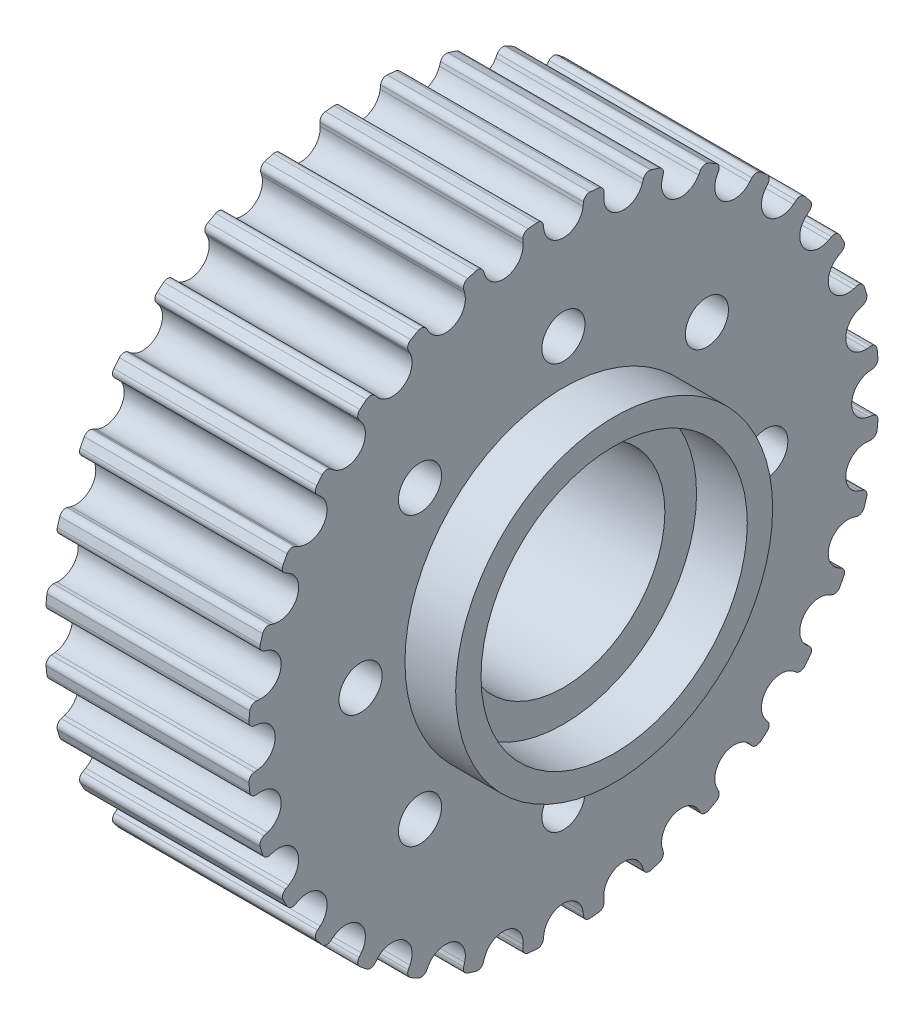
from build123d import *

# Parameters (mm, degrees)
CUT_EXTRUDE_2_REACH      = 42.489
PATTERN_CIRCULAR_3_COUNT = 32
SKETCH_8_R               = 12.5
EXTRUDE_1_DEPTH          = 4
SKETCH_9_R               = 10.5
CUT_EXTRUDE_3_DEPTH      = 4
SKETCH_10_R              = 8
CUT_EXTRUDE_4_DEPTH      = 58.1
SKETCH_11_R              = 1.7
CUT_EXTRUDE_5_DEPTH      = 69


with BuildPart() as part:
    # 草图1 → 旋转1 (revolve)
    with BuildSketch(Plane.XY):
        Polygon((0, 2.7506), (0, 24.893), (16, 24.893), (16, 5.5012), (20, 5.5012), (20, 2.7506), align=None)
    revolve(axis=Axis((0, 0, 0), (1, 0, 0)))

    # 草图6 → 切除-拉伸2 (cut, up to next)
    with BuildSketch(Plane(origin=(0, 0, 0), x_dir=(0, 0, -1), z_dir=(1, 0, 0)), mode=Mode.PRIVATE) as cut_extrude_2_sk1:
        with BuildLine():
            Line((1.582947984, 24.384482643), (1.548371997, 24.102883824))
            ThreePointArc((1.548371997, 24.102883824), (0, 22.733), (-1.548371997, 24.102883824))
            Line((-1.548371997, 24.102883824), (-1.582947984, 24.384482643))
            ThreePointArc((-1.582947984, 24.384482643), (-1.756772423, 24.698590543), (-2.099860763, 24.804274506))
            ThreePointArc((-2.099860763, 24.804274506), (-2.33890774, 24.782876338), (-2.5777373, 24.759174449))
            Line((-2.5777373, 24.759174449), (-2.774385289, 26.360743791))
            ThreePointArc((-2.774385289, 26.360743791), (0, 26.506339373), (2.774385289, 26.360743791))
            Line((2.774385289, 26.360743791), (2.5777373, 24.759174449))
            ThreePointArc((2.5777373, 24.759174449), (2.33890774, 24.782876338), (2.099860763, 24.804274506))
            ThreePointArc((2.099860763, 24.804274506), (1.756772423, 24.698590543), (1.582947984, 24.384482643))
        make_face()
    cut_extrude_2_tool1 = extrude(cut_extrude_2_sk1.sketch, amount=CUT_EXTRUDE_2_REACH, mode=Mode.PRIVATE) & part.part
    cut_extrude_2 = cut_extrude_2_tool1.solids().sort_by_distance((0, 24.97937, 0))[0]
    add(cut_extrude_2, mode=Mode.SUBTRACT)

    # 阵列(圆周)3: 切除-拉伸2 ×32 about axis
    pattern_circular_3_axis = Axis((-1, 0, 0), (1, 0, 0))
    for i in range(1, PATTERN_CIRCULAR_3_COUNT):
        add(cut_extrude_2.rotate(pattern_circular_3_axis, i * 360 / PATTERN_CIRCULAR_3_COUNT), mode=Mode.SUBTRACT)

    # 草图8 → 凸台-拉伸1 (add)
    with BuildSketch(Plane(origin=(16, 0, 0), x_dir=(0, 0, -1), z_dir=(1, 0, 0))):
        Circle(SKETCH_8_R)
    extrude_1 = extrude(amount=EXTRUDE_1_DEPTH)

    # 草图9 → 切除-拉伸3 (cut)
    with BuildSketch(Plane(origin=(20, 0, 0), x_dir=(0, 0, -1), z_dir=(1, 0, 0))):
        Circle(SKETCH_9_R)
    cut_extrude_3 = extrude(amount=-CUT_EXTRUDE_3_DEPTH, mode=Mode.SUBTRACT)

    # 草图10 → 切除-拉伸4 (cut)
    with BuildSketch(Plane(origin=(16, 0, 0), x_dir=(0, 0, -1), z_dir=(1, 0, 0))):
        Circle(SKETCH_10_R)
    extrude(amount=-CUT_EXTRUDE_4_DEPTH, mode=Mode.SUBTRACT)

    # 镜向1: 凸台-拉伸1, 切除-拉伸3 across plane
    add(extrude_1.mirror(Plane(origin=(8, 0, 0), x_dir=(0, 0, 1), z_dir=(1, 0, 0))))
    add(cut_extrude_3.mirror(Plane(origin=(8, 0, 0), x_dir=(0, 0, 1), z_dir=(1, 0, 0))), mode=Mode.SUBTRACT)

    # 草图11 → 切除-拉伸5 (cut)
    with BuildSketch(Plane(origin=(16, 0, 0), x_dir=(0, 0, -1), z_dir=(1, 0, 0))):
        with Locations((0, 16)):
            Circle(SKETCH_11_R)
        with Locations((11.313708499, 11.313708499)):
            Circle(SKETCH_11_R)
        with Locations((16, 0)):
            Circle(SKETCH_11_R)
        with Locations((11.313708499, -11.313708499)):
            Circle(SKETCH_11_R)
        with Locations((0, -16)):
            Circle(SKETCH_11_R)
        with Locations((-11.313708499, -11.313708499)):
            Circle(SKETCH_11_R)
        with Locations((-16, 0)):
            Circle(SKETCH_11_R)
        with Locations((-11.313708499, 11.313708499)):
            Circle(SKETCH_11_R)
    extrude(amount=-CUT_EXTRUDE_5_DEPTH, mode=Mode.SUBTRACT)


solid = part.part
